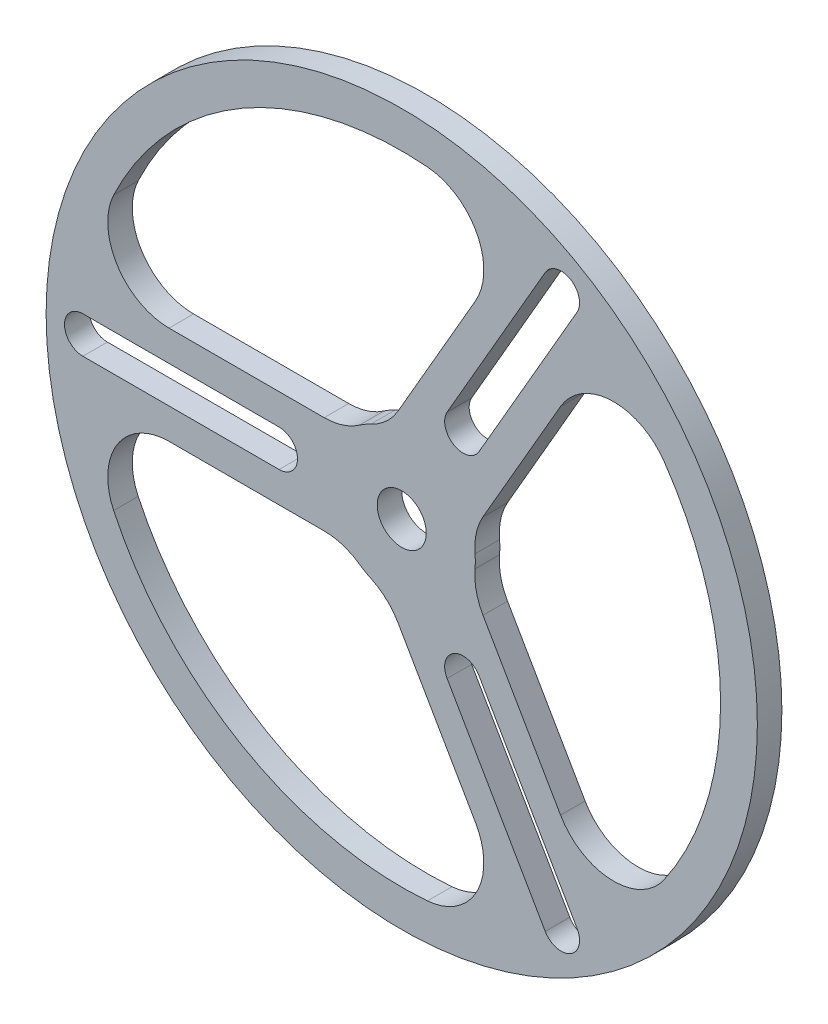
from build123d import *

# Parameters (mm, degrees)
SKETCH_1_R          = 29
SKETCH_1_R_2        = 2
EXTRUDE_1_DEPTH     = 2
CUT_EXTRUDE_1_DEPTH = 2


with BuildPart() as part:
    # 草图1 → 凸台-拉伸1 (new body)
    with BuildSketch(Plane.XY):
        Circle(SKETCH_1_R)
        Circle(SKETCH_1_R_2, mode=Mode.SUBTRACT)
        with BuildLine():
            Line((-10, -1.5), (-26, -1.5))
            ThreePointArc((-26, -1.5), (-27.5, 0), (-26, 1.5))
            Line((-26, 1.5), (-10, 1.5))
            ThreePointArc((-10, 1.5), (-8.5, 0), (-10, -1.5))
        make_face(mode=Mode.SUBTRACT)
        with BuildLine():
            Line((3.700961894, 9.410254038), (11.700961894, 23.266660498))
            ThreePointArc((11.700961894, 23.266660498), (13.75, 23.815698604), (14.299038106, 21.766660498))
            Line((14.299038106, 21.766660498), (6.299038106, 7.910254038))
            ThreePointArc((6.299038106, 7.910254038), (4.25, 7.361215932), (3.700961894, 9.410254038))
        make_face(mode=Mode.SUBTRACT)
        with BuildLine():
            Line((6.299038106, -7.910254038), (14.299038106, -21.766660498))
            ThreePointArc((14.299038106, -21.766660498), (13.75, -23.815698604), (11.700961894, -23.266660498))
            Line((11.700961894, -23.266660498), (3.700961894, -9.410254038))
            ThreePointArc((3.700961894, -9.410254038), (4.25, -7.361215932), (6.299038106, -7.910254038))
        make_face(mode=Mode.SUBTRACT)
    extrude(amount=EXTRUDE_1_DEPTH)

    # 草图2 → 切除-拉伸1 (cut)
    with BuildSketch(Plane.XY.offset(2)):
        with BuildLine():
            Line((-18.973665961, 4), (-6.32455532, 4))
            ThreePointArc((-6.32455532, 4), (-4.816998597, 4.232687054), (-3.449757447, 4.909090909))
            ThreePointArc((-3.449757447, 4.909090909), (-3, 5.196152423), (-2.526518713, 5.442123041))
            ThreePointArc((-2.526518713, 5.442123041), (-1.257115216, 6.287986682), (-0.301823955, 7.477225575))
            Line((-0.301823955, 7.477225575), (6.022731365, 18.431676725))
            ThreePointArc((6.022731365, 18.431676725), (6.120040233, 23.254995789), (2.095605381, 25.915409279))
            ThreePointArc((2.095605381, 25.915409279), (-13, 22.516660498), (-23.491205476, 11.142857143))
            ThreePointArc((-23.491205476, 11.142857143), (-23.199437235, 6.327387581), (-18.973665961, 4))
        make_face()
        with BuildLine():
            Line((-18.973665961, -4), (-6.32455532, -4))
            ThreePointArc((-6.32455532, -4), (-4.816998597, -4.232687054), (-3.449757447, -4.909090909))
            ThreePointArc((-3.449757447, -4.909090909), (-3, -5.196152423), (-2.526518713, -5.442123041))
            ThreePointArc((-2.526518713, -5.442123041), (-1.257115216, -6.287986682), (-0.301823955, -7.477225575))
            Line((-0.301823955, -7.477225575), (6.022731365, -18.431676725))
            ThreePointArc((6.022731365, -18.431676725), (6.120040233, -23.254995789), (2.095605381, -25.915409279))
            ThreePointArc((2.095605381, -25.915409279), (-13, -22.516660498), (-23.491205476, -11.142857143))
            ThreePointArc((-23.491205476, -11.142857143), (-23.199437235, -6.327387581), (-18.973665961, -4))
        make_face()
        with BuildLine():
            Line((12.950934596, 14.431676725), (6.626379275, 3.477225575))
            ThreePointArc((6.626379275, 3.477225575), (6.074113814, 2.055299628), (5.97627616, 0.533032132))
            ThreePointArc((5.97627616, 0.533032132), (6, 0), (5.97627616, -0.533032132))
            ThreePointArc((5.97627616, -0.533032132), (6.074113814, -2.055299628), (6.626379275, -3.477225575))
            Line((6.626379275, -3.477225575), (12.950934596, -14.431676725))
            ThreePointArc((12.950934596, -14.431676725), (17.079397002, -16.927608208), (21.395600094, -14.772552136))
            ThreePointArc((21.395600094, -14.772552136), (26, 0), (21.395600094, 14.772552136))
            ThreePointArc((21.395600094, 14.772552136), (17.079397002, 16.927608208), (12.950934596, 14.431676725))
        make_face()
    extrude(amount=-CUT_EXTRUDE_1_DEPTH, mode=Mode.SUBTRACT)


solid = part.part
